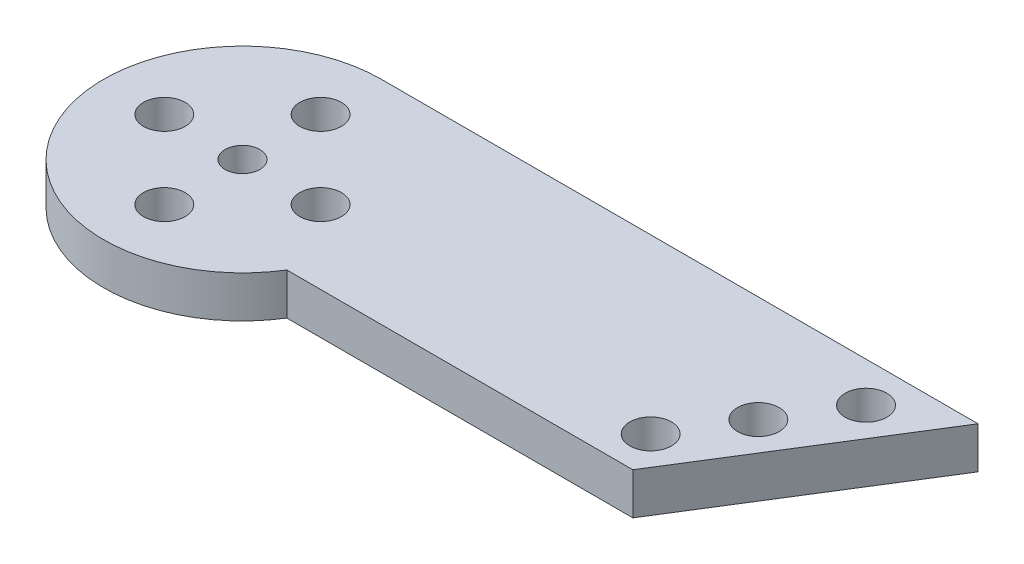
from build123d import *

# Parameters (mm, degrees)
SKETCH1_R           = 1.2
SKETCH1_R_2         = 1
BOSS_EXTRUDE1_DEPTH = 2.4
CUT_EXTRUDE1_DEPTH  = 24.69949444


with BuildPart() as part:
    # Sketch1 → Boss-Extrude1 (new body)
    with BuildSketch(Plane(origin=(0, 0, 0), x_dir=(1, 0, 0), z_dir=(0, 1, 0))):
        with BuildLine():
            Line((-12.181045185, 8), (22.178954815, 8))
            Line((22.178954815, 8), (12.181045185, -8))
            Line((12.181045185, -8), (-12.181045185, -8))
            ThreePointArc((-12.181045185, -8), (-20.181045185, 0), (-12.181045185, 8))
        make_face()
        with Locations(Location((-12.181045185, 4.5, 0), (0, 0, 270))):
            Circle(SKETCH1_R, mode=Mode.SUBTRACT)
        with Locations(Location((-7.681045185, 0, 0), (0, 0, 270))):
            Circle(SKETCH1_R, mode=Mode.SUBTRACT)
        with Locations(Location((-12.181045185, -4.5, 0), (0, 0, 270))):
            Circle(SKETCH1_R, mode=Mode.SUBTRACT)
        with Locations(Location((-16.681045185, 0, 0), (0, 0, 270))):
            Circle(SKETCH1_R, mode=Mode.SUBTRACT)
        with Locations(Location((18.029644978, 5.7, 0), (0, 0, 270))):
            Circle(SKETCH1_R, mode=Mode.SUBTRACT)
        with Locations(Location((13.2603716, -1.932432865, 0), (0, 0, 270))):
            Circle(SKETCH1_R, mode=Mode.SUBTRACT)
        with Locations(Location((15.645008289, 1.883783567, 0), (0, 0, 270))):
            Circle(SKETCH1_R, mode=Mode.SUBTRACT)
        with Locations(Location((-12.181045185, 0, 0), (0, 0, 270))):
            Circle(SKETCH1_R_2, mode=Mode.SUBTRACT)
    extrude(amount=BOSS_EXTRUDE1_DEPTH)

    # Sketch2 → Cut-Extrude1 (cut, through all)
    with BuildSketch(Plane(origin=(0, 2.4, 0), x_dir=(1, 0, 0), z_dir=(0, 1, 0))):
        with BuildLine():
            Line((14.535282418, -4.232432865), (-5.392340445, -4.232432865))
            ThreePointArc((-5.392340445, -4.232432865), (-8.299000809, -6.994979018), (-12.181045185, -8))
            Line((-12.181045185, -8), (12.181045185, -8))
            Line((12.181045185, -8), (14.535282418, -4.232432865))
        make_face()
    extrude(amount=-CUT_EXTRUDE1_DEPTH, mode=Mode.SUBTRACT)


solid = part.part
